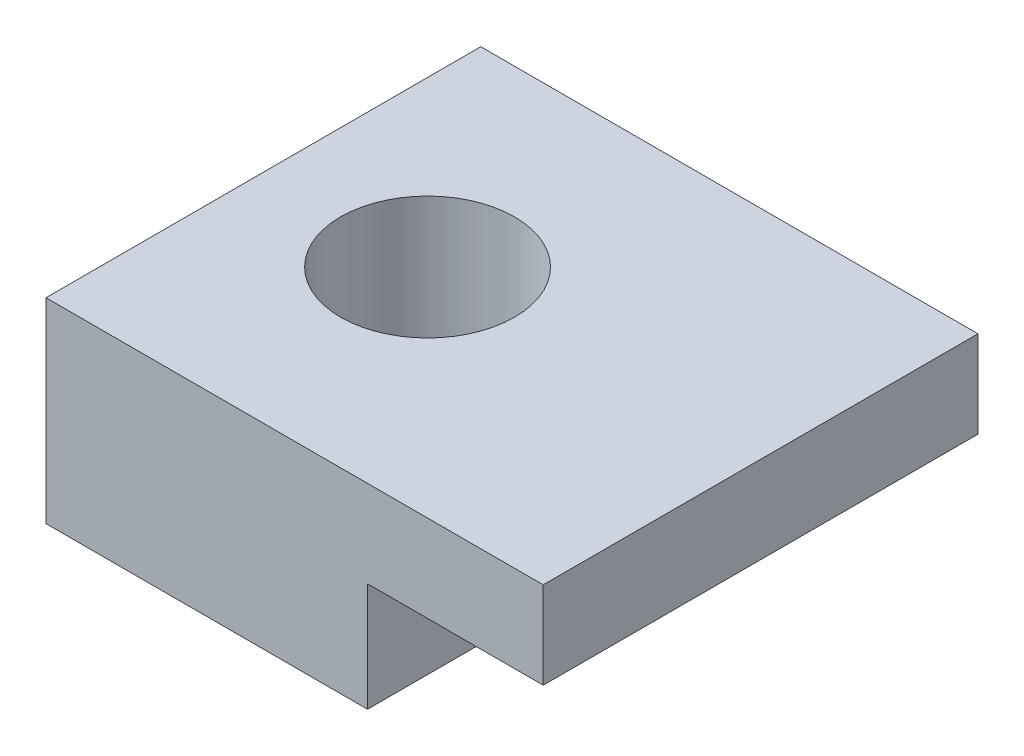
from build123d import *

# Parameters (mm, degrees)
BOSS_EXTRUDE1_DEPTH = 10
SKETCH2_R           = 2
CUT_EXTRUDE1_DEPTH  = 10


with BuildPart() as part:
    # Sketch1 → Boss-Extrude1 (new body)
    with BuildSketch(Plane.XY):
        Polygon((-3.776335995, 0), (-3.776335995, 4.5), (7.660190506, 4.5), (7.660190506, 2.5), (3.618784046, 2.5), (3.618784046, 0), align=None)
    extrude(amount=BOSS_EXTRUDE1_DEPTH)

    # Sketch2 → Cut-Extrude1 (cut)
    with BuildSketch(Plane(origin=(0, 4.5, 0), x_dir=(1, 0, 0), z_dir=(0, 1, 0))):
        with Locations(Location((0, -5, 0), (0, 0, 270))):
            Circle(SKETCH2_R)
    extrude(amount=-CUT_EXTRUDE1_DEPTH, mode=Mode.SUBTRACT)


solid = part.part
